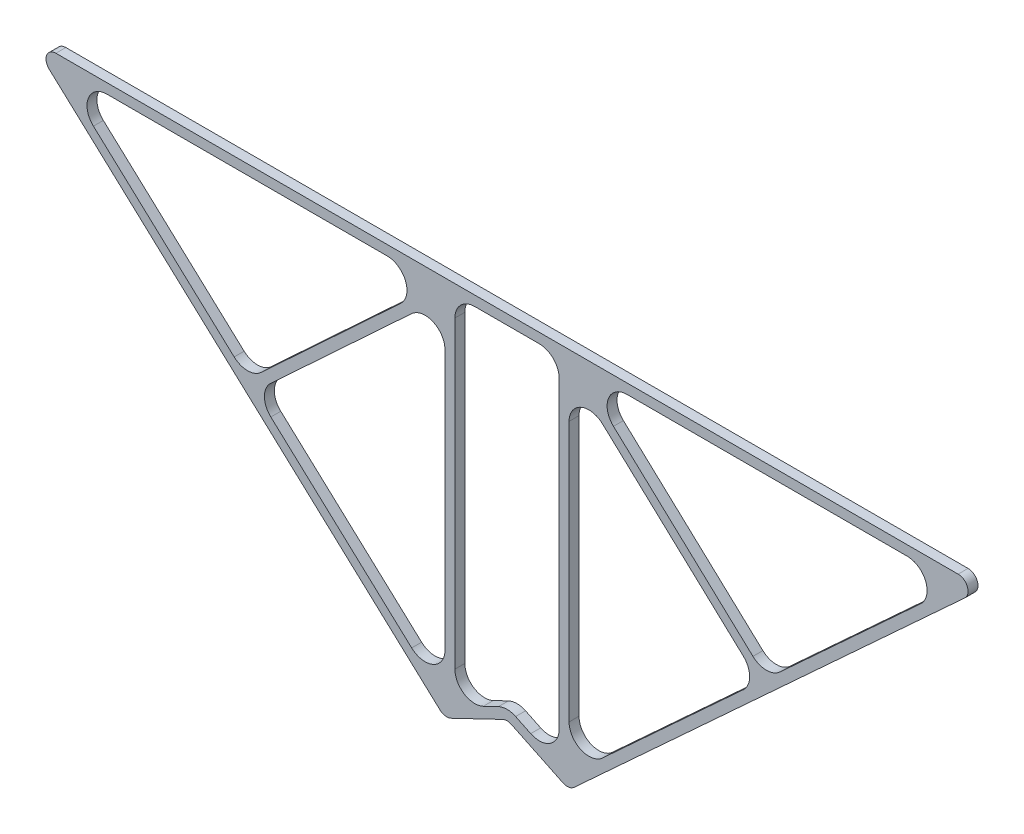
from build123d import *

# Parameters (mm, degrees)
BOSS_EXTRUDE1_DEPTH     = 3.175
FILLET1_R               = 3.175
CUT_EXTRUDE1_DEPTH      = 192.340110238
CUT_EXTRUDE1_DEPTH_BACK = 192.340110238
FILLET2_R               = 6.35


with BuildPart() as part:
    # Sketch1 → Boss-Extrude1 (new body)
    with BuildSketch(Plane.XY):
        Polygon((-19.84375, 0), (0, 9.525), (19.84375, 0), (152.4, 121.92), (-152.4, 121.92), align=None)
    extrude(amount=BOSS_EXTRUDE1_DEPTH)

    # Fillet1
    fillet1_edges = [part.edges().sort_by_distance(p)[0] for p in [
        (0, 9.525, 1.5875),
        (-19.84375, 0, 1.5875),
        (-152.4, 121.92, 1.5875),
        (152.4, 121.92, 1.5875),
        (19.84375, 0, 1.5875),
    ]]
    fillet(fillet1_edges, radius=FILLET1_R)

    # Sketch2 → Cut-Extrude1 (cut, two sides: drawn at the far end of the back side and taken through both)
    with BuildSketch(Plane.XY.offset(3.175).offset(-CUT_EXTRUDE1_DEPTH_BACK)):
        Polygon((-82.940049134, 62.347230555), (-22.177311492, 118.745), (-144.257936486, 118.745), align=None)
        Polygon((-19.84375, 4.313748238), (-19.84375, 116.579072853), (-80.595875999, 60.191152749), align=None)
        with BuildLine():
            Line((16.66875, 5.045817854), (16.66875, 118.745))
            Line((16.66875, 118.745), (-16.66875, 118.745))
            Line((-16.66875, 118.745), (-16.66875, 5.045817854))
            Line((-16.66875, 5.045817854), (-2.747842279, 11.72785356))
            ThreePointArc((-2.747842279, 11.72785356), (0, 12.353182146), (2.747842279, 11.72785356))
            Line((2.747842279, 11.72785356), (16.66875, 5.045817854))
        make_face()
        Polygon((80.595875999, 60.191152749), (19.84375, 116.579072853), (19.84375, 4.313748238), align=None)
        Polygon((144.257936486, 118.745), (22.177311492, 118.745), (82.940049134, 62.347230555), align=None)
    extrude(amount=CUT_EXTRUDE1_DEPTH + CUT_EXTRUDE1_DEPTH_BACK, mode=Mode.SUBTRACT)

    # Fillet2
    fillet2_edges = [part.edges().sort_by_distance(p)[0] for p in [
        (-22.177311492, 118.745, 1.5875),
        (-82.940049134, 62.347230555, 1.5875),
        (-144.257936486, 118.745, 1.5875),
        (19.84375, 116.579072853, 1.5875),
        (80.595875999, 60.191152749, 1.5875),
        (19.84375, 4.313748238, 1.5875),
        (22.177311492, 118.745, 1.5875),
        (144.257936486, 118.745, 1.5875),
        (82.940049134, 62.347230555, 1.5875),
        (-16.66875, 5.045817854, 1.5875),
        (-16.66875, 118.745, 1.5875),
        (16.66875, 118.745, 1.5875),
        (16.66875, 5.045817854, 1.5875),
        (-19.84375, 116.579072853, 1.5875),
        (-19.84375, 4.313748238, 1.5875),
        (-80.595875999, 60.191152749, 1.5875),
    ]]
    fillet(fillet2_edges, radius=FILLET2_R)


solid = part.part
